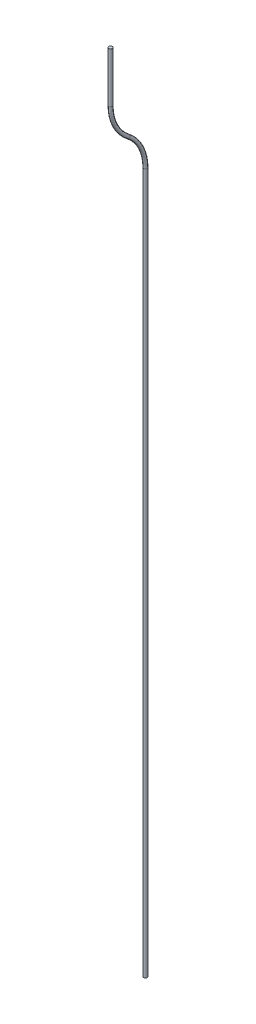
from build123d import *

# Parameters (mm, degrees)
UTILITY_CIRCULAR_CROSS_SECTION_R = 0.6


with BuildPart() as part:
    # Native hollow utility sweep: sweep along a path in Illustrative smooth utility route
    with BuildLine(Plane(origin=(0, 0, 0), x_dir=(0, 0, -1), z_dir=(1, 0, 0))) as native_hollow_utility_sweep_path:
        Line((-16.25, 0), (-16.25, -16.9))
        ThreePointArc((-16.25, -16.9), (-14.702430847, -23.580486977), (-10.375, -28.9))
        ThreePointArc((-10.375, -28.9), (-6.047569153, -34.219513023), (-4.5, -40.9))
        Line((-4.5, -40.9), (-4.5, -276.9))
    # Utility circular cross section → Native hollow utility sweep (sweep)
    with BuildSketch(Plane(origin=(0, 0, 0), x_dir=(1, 0, 0), z_dir=(0, 1, 0))):
        with Locations((0, -16.25)):
            Circle(UTILITY_CIRCULAR_CROSS_SECTION_R)
    sweep(path=native_hollow_utility_sweep_path.line)


solid = part.part
